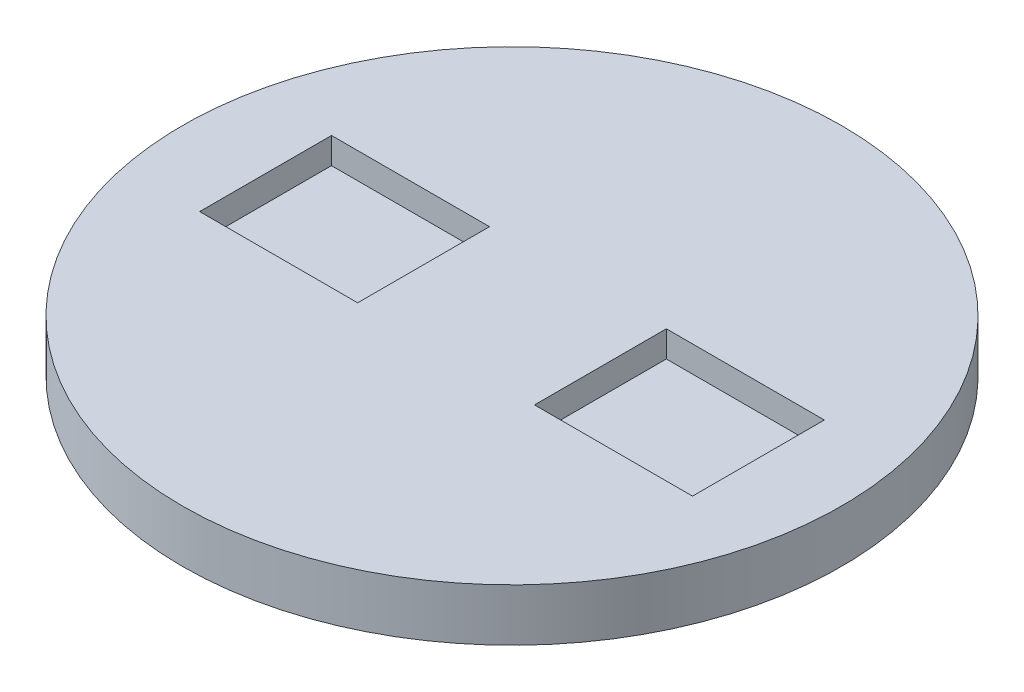
from build123d import *

# Parameters (mm, degrees)
SKETCH_1_R          = 62.989422777
EXTRUDE_1_DEPTH     = 10
SKETCH_2_W          = 30.2
SKETCH_2_H          = 25.2
CUT_EXTRUDE_1_DEPTH = 5


with BuildPart() as part:
    # 草图1 → 凸台-拉伸1 (new body)
    with BuildSketch(Plane(origin=(0, 0, 0), x_dir=(1, 0, 0), z_dir=(0, 1, 0))):
        with Locations(Location((0, 0, 0), (0, 0, 270))):
            Circle(SKETCH_1_R)
    extrude(amount=EXTRUDE_1_DEPTH)

    # 草图2 → 切除-拉伸1 (cut)
    with BuildSketch(Plane(origin=(0, 10, 0), x_dir=(1, 0, 0), z_dir=(0, 1, 0))):
        with Locations((-32, 0)):
            Rectangle(SKETCH_2_W, SKETCH_2_H)
        with Locations((32, 0)):
            Rectangle(SKETCH_2_W, SKETCH_2_H)
    extrude(amount=-CUT_EXTRUDE_1_DEPTH, mode=Mode.SUBTRACT)


solid = part.part
